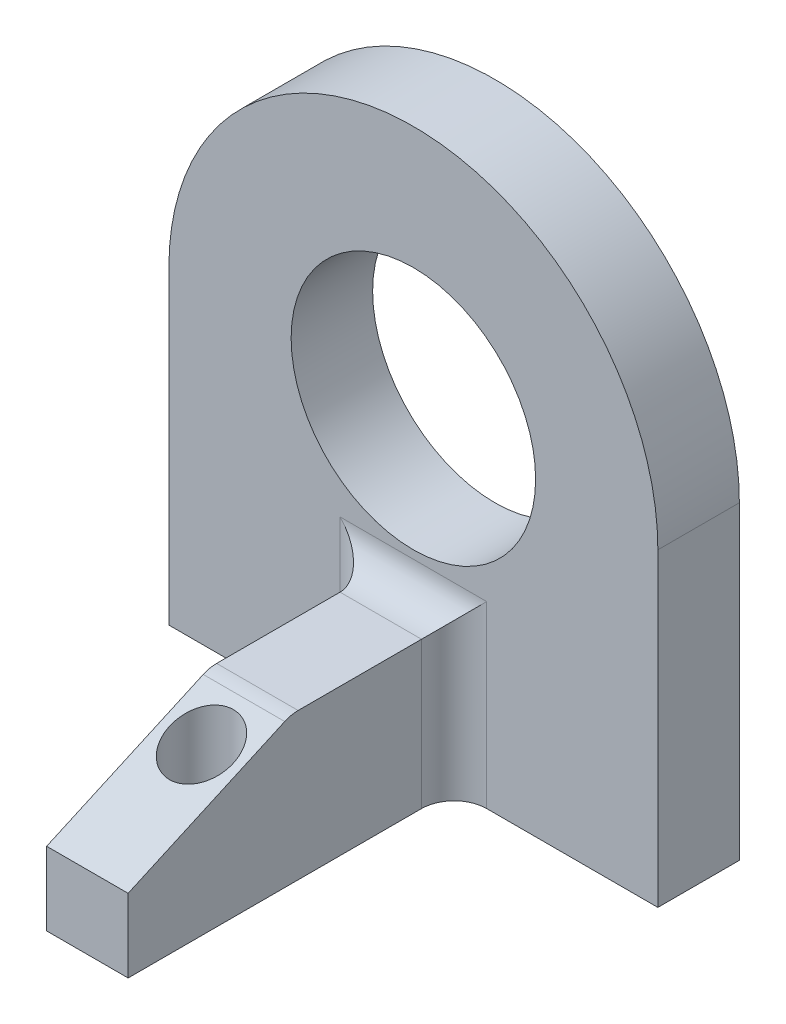
from build123d import *

# Parameters (mm, degrees)
SKETCH1_R           = 9.525
BOSS_EXTRUDE1_DEPTH = 6.35
SKETCH2_W           = 6.35
SKETCH2_H           = 11.43
BOSS_EXTRUDE2_DEPTH = 25.4
CUT_EXTRUDE1_DEPTH  = 25.4
SKETCH4_R           = 2.4892
CUT_EXTRUDE2_DEPTH  = 12.7
FILLET1_R           = 2.54


with BuildPart() as part:
    # Sketch1 → Boss-Extrude1 (new body)
    with BuildSketch(Plane.XY):
        with BuildLine():
            Line((19.05, 0), (19.05, 24.13))
            ThreePointArc((19.05, 24.13), (0, 43.18), (-19.05, 24.13))
            Line((-19.05, 24.13), (-19.05, 0))
            Line((-19.05, 0), (19.05, 0))
        make_face()
        with Locations((0, 24.13)):
            Circle(SKETCH1_R, mode=Mode.SUBTRACT)
    extrude(amount=BOSS_EXTRUDE1_DEPTH)

    # Sketch2 → Boss-Extrude2 (add)
    with BuildSketch(Plane.XY.offset(6.35)):
        with Locations((0, 5.715)):
            Rectangle(SKETCH2_W, SKETCH2_H)
    extrude(amount=BOSS_EXTRUDE2_DEPTH)

    # Sketch3 → Cut-Extrude1 (cut)
    with BuildSketch(Plane(origin=(3.175, 0, 0), x_dir=(0, 0, -1), z_dir=(1, 0, 0))):
        Polygon((-31.75, 5.715), (-19.05, 11.43), (-31.75, 11.43), align=None)
    extrude(amount=-CUT_EXTRUDE1_DEPTH, mode=Mode.SUBTRACT)

    # Sketch4 → Cut-Extrude2 (cut)
    with BuildSketch(Plane.XZ):
        with Locations(Location((-9.525, 3.175, 0), (0, 0, 270))):
            Circle(SKETCH4_R)
        with Locations(Location((9.525, 3.175, 0), (0, 0, 270))):
            Circle(SKETCH4_R)
        with Locations(Location((0, 22.86, 0), (0, 0, 270))):
            Circle(SKETCH4_R)
    extrude(amount=-CUT_EXTRUDE2_DEPTH, mode=Mode.SUBTRACT)

    # Fillet1
    fillet1_edges = [part.edges().sort_by_distance(p)[0] for p in [
        (0, 11.43, 19.05),
        (3.175, 5.715, 6.35),
        (0, 11.43, 6.35),
        (-3.175, 5.715, 6.35),
    ]]
    fillet(fillet1_edges, radius=FILLET1_R)


solid = part.part
